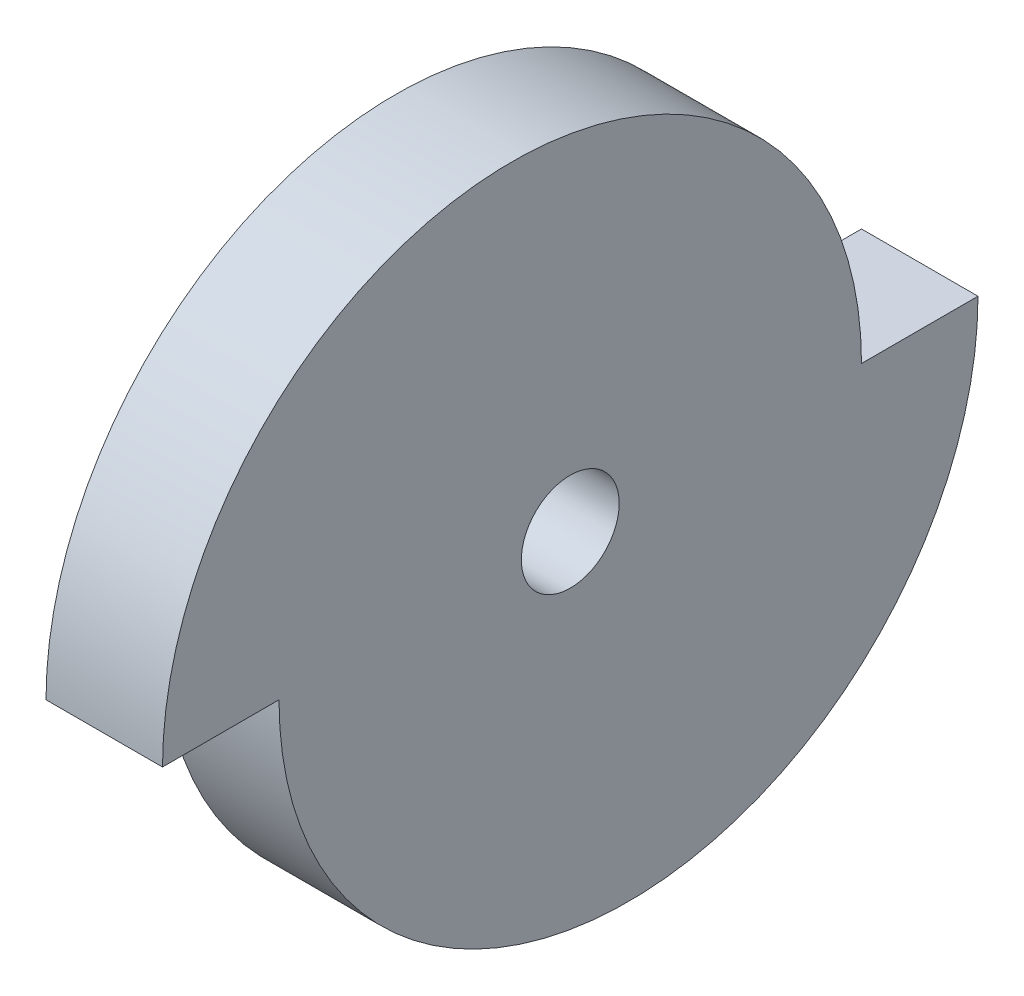
from build123d import *

# Parameters (mm, degrees)
BOSS_EXTRUDE1_DEPTH       = 5
M5X0_8_TAPPED_HOLE1_D     = 4.2
M5X0_8_TAPPED_HOLE1_DEPTH = 12.4
M5X0_8_TAPPED_HOLE1_TIP   = 1.2618073


with BuildPart() as part:
    # Sketch1 → Boss-Extrude1 (new body)
    with BuildSketch(Plane(origin=(0, 0, 0), x_dir=(0, 0, -1), z_dir=(1, 0, 0))):
        with BuildLine():
            Line((75.286672608, 0), (80.286672608, 0))
            ThreePointArc((80.286672608, 0), (65.286672608, -15), (50.286672608, 0))
            Line((50.286672608, 0), (45.286672608, 0))
            ThreePointArc((45.286672608, 0), (60.286672608, 15), (75.286672608, 0))
        make_face()
    extrude(amount=BOSS_EXTRUDE1_DEPTH)

    # M5x0.8 Tapped Hole1
    with Locations(Plane(origin=(5, 0, 0), x_dir=(0, 0, -1), z_dir=(1, 0, 0))):
        with Locations((62.786672608, 0)):
            Hole(M5X0_8_TAPPED_HOLE1_D / 2, depth=M5X0_8_TAPPED_HOLE1_DEPTH)
            with Locations((0, 0, -(M5X0_8_TAPPED_HOLE1_DEPTH + M5X0_8_TAPPED_HOLE1_TIP / 2))):  # 118° drill point
                Cone(0, M5X0_8_TAPPED_HOLE1_D / 2, M5X0_8_TAPPED_HOLE1_TIP, mode=Mode.SUBTRACT)


solid = part.part
